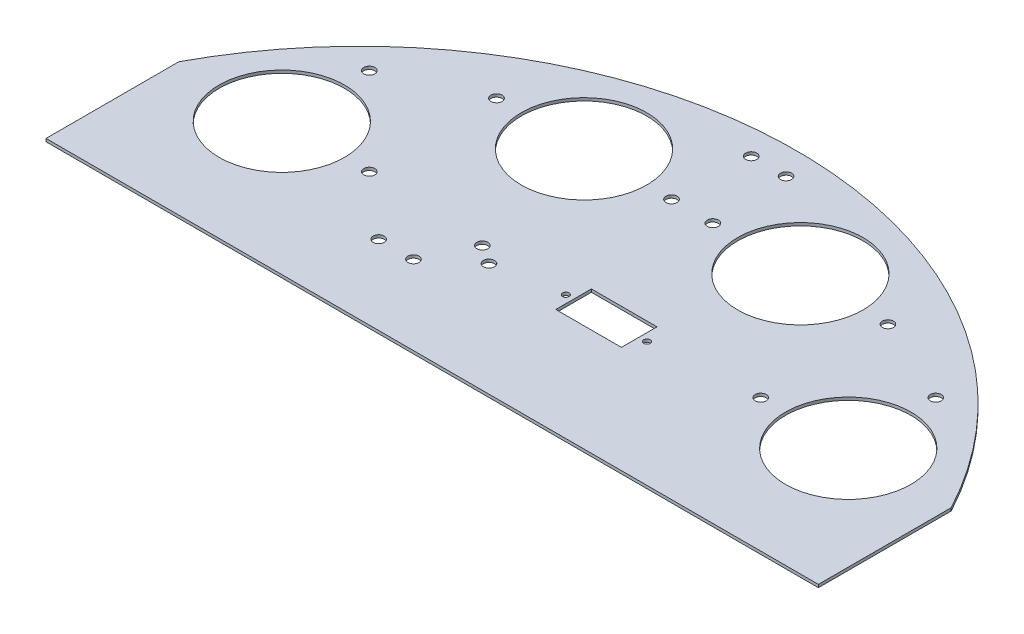
from build123d import *

# Parameters (mm, degrees)
SKETCH3_R             = 21.5
BOSS_EXTRUDE3_DEPTH   = 1
SKETCH10_R            = 1.1
SKETCH10_W            = 22.5
SKETCH10_H            = 12.2
CUT_EXTRUDE3_DEPTH    = 170.731914631
F_6_CLEARANCE_HOLE1_D = 3.7973


with BuildPart() as part:
    # Sketch3 → Boss-Extrude3 (new body)
    with BuildSketch(Plane(origin=(0, 0, 0), x_dir=(1, 0, 0), z_dir=(0, 1, 0))):
        with BuildLine():
            Line((-132.226234517, -18.972612677), (132.537224892, -18.972612677))
            Line((132.537224892, -18.972612677), (132.537224892, 26.561617598))
            ThreePointArc((132.537224892, 26.561617598), (0.155495187, 106.027387323), (-132.226234517, 26.561617598))
            Line((-132.226234517, 26.561617598), (-132.226234517, -18.972612677))
        make_face()
        with Locations(Location((-96.926544138, 26.561617598, 0), (0, 0, 270))):
            Circle(SKETCH3_R, mode=Mode.SUBTRACT)
        with Locations(Location((97.237534512, 26.561617598, 0), (0, 0, 270))):
            Circle(SKETCH3_R, mode=Mode.SUBTRACT)
        with Locations(Location((-36.926544138, 70.154169278, 0), (0, 0, 270))):
            Circle(SKETCH3_R, mode=Mode.SUBTRACT)
        with Locations(Location((37.237534512, 70.154169278, 0), (0, 0, 270))):
            Circle(SKETCH3_R, mode=Mode.SUBTRACT)
    extrude(amount=BOSS_EXTRUDE3_DEPTH)

    # Sketch10 → Cut-Extrude3 (cut, through all)
    with BuildSketch(Plane(origin=(0, 0, 0), x_dir=(-1, 0, 0), z_dir=(0, -1, 0))):
        with Locations(Location((-31.076423082, 23.72316033, 0), (0, 0, 90))):
            Circle(SKETCH10_R)
        with Locations(Location((-3.276423082, 23.72316033, 0), (0, 0, 90))):
            Circle(SKETCH10_R)
        with Locations((-17.176423082, 23.72316033)):
            Rectangle(SKETCH10_W, SKETCH10_H)
    extrude(amount=-CUT_EXTRUDE3_DEPTH, mode=Mode.SUBTRACT)

    # #6 Clearance Hole1 (through all)
    with Locations(Plane(origin=(0, 0, 0), x_dir=(-1, 0, 0), z_dir=(0, -1, 0))):
        with Locations((-97.237534512, 56.561617598), (-67.237534512, 26.561617598), (-67.237534512, 70.154169278), (-7.237534512, 70.154169278), (6.926544138, 70.154169278), (66.926544138, 70.154169278), (96.926544138, 56.561617598), (66.926544138, 26.561617598), (19.154347381, 19.79486368), (45.291365084, 8.12316033), (33.361365084, 8.12316033), (6.061135322, 96.611330123), (-5.86886721, 96.611330123), (25.648240263, 24.024740184)):
            Hole(F_6_CLEARANCE_HOLE1_D / 2)


solid = part.part
